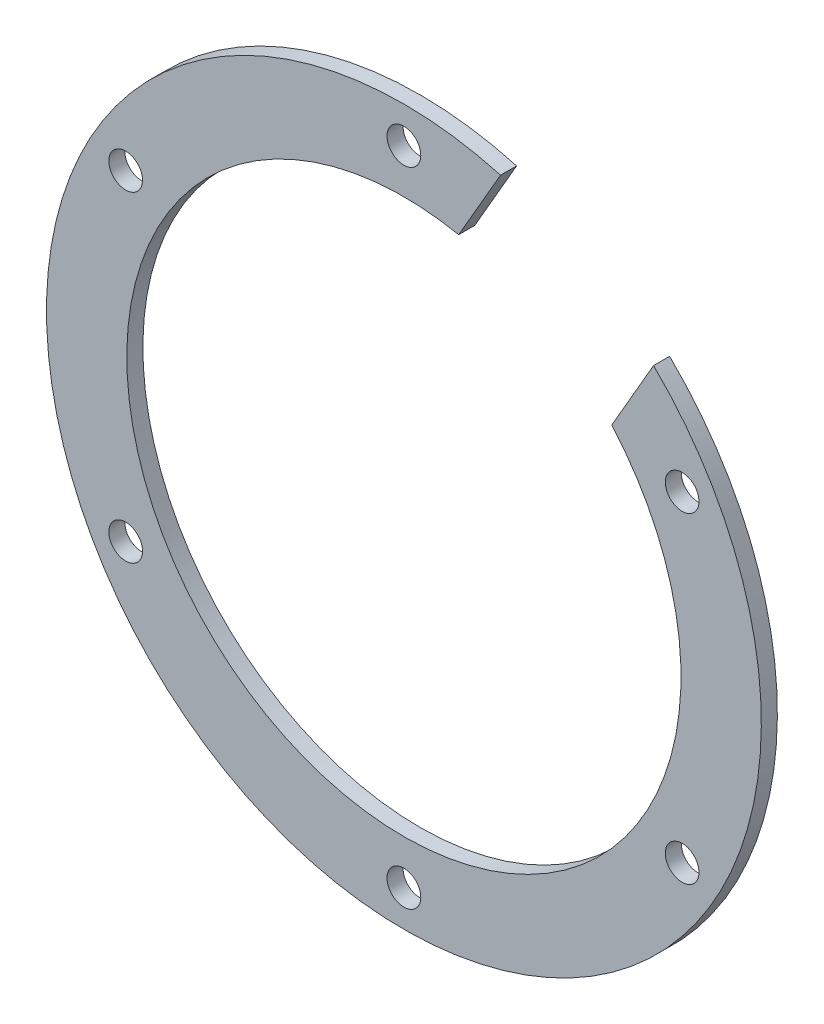
from build123d import *

# Parameters (mm, degrees)
SKETCH_1_R          = 44.5
SKETCH_1_R_2        = 34.5
EXTRUDE_1_DEPTH     = 2
SKETCH_2_R          = 2.1
CUT_EXTRUDE_1_DEPTH = 26
CUT_EXTRUDE_2_DEPTH = 26


with BuildPart() as part:
    # 草图1 → 凸台-拉伸1 (new body)
    with BuildSketch(Plane.XY):
        Circle(SKETCH_1_R)
        Circle(SKETCH_1_R_2, mode=Mode.SUBTRACT)
    extrude(amount=EXTRUDE_1_DEPTH)

    # 草图2 → 切除-拉伸1 (cut)
    with BuildSketch(Plane.XY.offset(2)):
        with Locations((0, 40)):
            Circle(SKETCH_2_R)
        with Locations((34.641016151, 20)):
            Circle(SKETCH_2_R)
        with Locations((34.641016151, -20)):
            Circle(SKETCH_2_R)
        with Locations((0, -40)):
            Circle(SKETCH_2_R)
        with Locations((-34.641016151, -20)):
            Circle(SKETCH_2_R)
        with Locations((-34.641016151, 20)):
            Circle(SKETCH_2_R)
    extrude(amount=-CUT_EXTRUDE_1_DEPTH, mode=Mode.SUBTRACT)

    # 草图3 → 切除-拉伸2 (cut)
    with BuildSketch(Plane.XY.offset(2)):
        Polygon((-6.056039584, 11.510631748), (15.427420122, 48.721075481), (34.479979005, 37.721075481), (12.996519299, 0.510631748), align=None)
    extrude(amount=-CUT_EXTRUDE_2_DEPTH, mode=Mode.SUBTRACT)


solid = part.part
